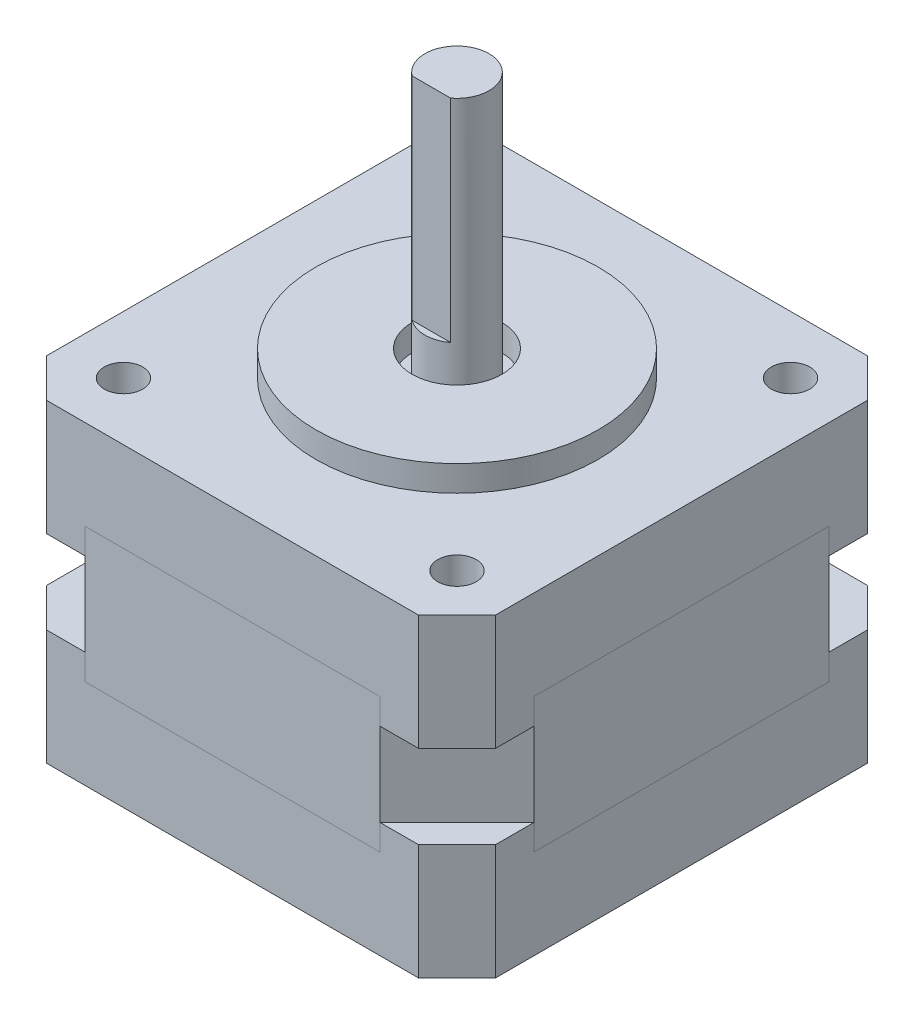
from build123d import *

# Parameters (mm, degrees)
BOSS_EXTRUDE1_DEPTH = 9
CUT_EXTRUDE7_DEPTH  = 2
BOSS_EXTRUDE2_DEPTH = 10.5
SKETCH11_R          = 11
BOSS_EXTRUDE3_DEPTH = 2
SKETCH12_R          = 2.5
CUT_EXTRUDE8_DEPTH  = 10.5
SKETCH13_R          = 3.5
CUT_EXTRUDE9_DEPTH  = 37.259481519
SKETCH14_R          = 2.5
BOSS_EXTRUDE4_DEPTH = 20.65
BOSS_EXTRUDE5_START = -2
SKETCH17_R          = 2.5
BOSS_EXTRUDE5_DEPTH = 22.5
CUT_EXTRUDE10_DEPTH = 16.5
SKETCH18_R          = 1.5
CUT_EXTRUDE11_DEPTH = 4
SKETCH19_R          = 3.45
SKETCH19_R_2        = 2.55
BOSS_EXTRUDE6_DEPTH = 1


with BuildPart() as part:
    # Sketch1 → Boss-Extrude1 (new body)
    with BuildSketch(Plane(origin=(0, 0, 0), x_dir=(1, 0, 0), z_dir=(0, 1, 0))):
        Polygon((-17.5, 14.5), (-14.5, 17.5), (14.5, 17.5), (17.5, 14.5), (17.5, -14.5), (14.5, -17.5), (-14.5, -17.5), (-17.5, -14.5), align=None)
    extrude(amount=-BOSS_EXTRUDE1_DEPTH)

    # Sketch9 → Cut-Extrude7 (cut)
    with BuildSketch(Plane.XZ.offset(9)):
        Polygon((-11.5, -17.5), (11.5, -17.5), (17.5, -11.5), (17.5, 11.5), (11.5, 17.5), (-11.5, 17.5), (-17.5, 11.5), (-17.5, -11.5), align=None)
    extrude(amount=-CUT_EXTRUDE7_DEPTH, mode=Mode.SUBTRACT)


with BuildPart() as body_2:
    # Sketch10 → Boss-Extrude2 (new body)
    with BuildSketch(Plane.XZ.offset(7)):
        Polygon((11.5, -17.5), (-11.5, -17.5), (-17.5, -11.5), (-17.5, 11.5), (-11.5, 17.5), (11.5, 17.5), (17.5, 11.5), (17.5, -11.5), align=None)
    extrude(amount=BOSS_EXTRUDE2_DEPTH)

    # Sketch12 → Cut-Extrude8 (cut)
    with BuildSketch(Plane(origin=(0, -7, 0), x_dir=(1, 0, 0), z_dir=(0, 1, 0))):
        with Locations(Location((0, 0, 0), (0, 0, 270))):
            Circle(SKETCH12_R)
    extrude(amount=-CUT_EXTRUDE8_DEPTH, mode=Mode.SUBTRACT)


with BuildPart() as body_3:
    # Mirror3: mirrored copy
    add(part.part.mirror(Plane.ZX.offset(-12.25)))


with BuildPart() as part_1:
    add(part.part)

    # Sketch11 → Boss-Extrude3 (add)
    with BuildSketch(Plane(origin=(0, 0, 0), x_dir=(1, 0, 0), z_dir=(0, 1, 0))):
        with Locations(Location((0, 0, 0), (0, 0, 270))):
            Circle(SKETCH11_R)
    extrude(amount=BOSS_EXTRUDE3_DEPTH)


with BuildPart() as cut_extrude9_tool:
    # Sketch13 → Cut-Extrude9 (new, through all)
    with BuildSketch(Plane(origin=(0, 2, 0), x_dir=(1, 0, 0), z_dir=(0, 1, 0))):
        with Locations(Location((0, 0, 0), (0, 0, 270))):
            Circle(SKETCH13_R)
    extrude(amount=-CUT_EXTRUDE9_DEPTH)


with BuildPart() as body_3_1:
    add(body_3.part)

    # Cut-Extrude9: cut by cut_extrude9_tool
    add(cut_extrude9_tool.part, mode=Mode.SUBTRACT)


with BuildPart() as part_2:
    add(part_1.part)

    # Cut-Extrude9: cut by cut_extrude9_tool
    add(cut_extrude9_tool.part, mode=Mode.SUBTRACT)

    # Sketch18 → Cut-Extrude11 (cut)
    with BuildSketch(Plane(origin=(0, 0, 0), x_dir=(1, 0, 0), z_dir=(0, 1, 0))):
        with Locations(Location((-13, 13, 0), (0, 0, 270))):
            Circle(SKETCH18_R)
        with Locations(Location((13, 13, 0), (0, 0, 90))):
            Circle(SKETCH18_R)
        with Locations(Location((13, -13, 0), (0, 0, 270))):
            Circle(SKETCH18_R)
        with Locations(Location((-13, -13, 0), (0, 0, 90))):
            Circle(SKETCH18_R)
    extrude(amount=-CUT_EXTRUDE11_DEPTH, mode=Mode.SUBTRACT)


with BuildPart() as body_4:
    # Sketch14 → Boss-Extrude4 (new body)
    with BuildSketch(Plane(origin=(0, 0, 0), x_dir=(1, 0, 0), z_dir=(0, 1, 0))):
        with Locations(Location((0, 0, 0), (0, 0, 90))):
            Circle(SKETCH14_R)
    extrude(amount=BOSS_EXTRUDE4_DEPTH)

    # Sketch17 → Boss-Extrude5 (add)
    with BuildSketch(Plane.XZ.offset(24.5).offset(BOSS_EXTRUDE5_START)):
        with Locations(Location((0, 0, 0), (0, 0, 270))):
            Circle(SKETCH17_R)
    extrude(amount=-BOSS_EXTRUDE5_DEPTH)

    # Sketch15 → Cut-Extrude10 (cut)
    with BuildSketch(Plane(origin=(0, 20.65, 0), x_dir=(1, 0, 0), z_dir=(0, 1, 0))):
        with BuildLine():
            Line((0, -2), (-1.5, -2))
            ThreePointArc((-1.5, -2), (0, -2.5), (1.5, -2))
            Line((1.5, -2), (0, -2))
        make_face()
    extrude(amount=-CUT_EXTRUDE10_DEPTH, mode=Mode.SUBTRACT)


with BuildPart() as body_5:
    # Sketch19 → Boss-Extrude6 (new body)
    with BuildSketch(Plane(origin=(0, 0, 0), x_dir=(1, 0, 0), z_dir=(0, 1, 0))):
        with Locations(Location((0, 0, 0), (0, 0, 270))):
            Circle(SKETCH19_R)
        with Locations(Location((0, 0, 0), (0, 0, 270))):
            Circle(SKETCH19_R_2, mode=Mode.SUBTRACT)
    extrude(amount=-BOSS_EXTRUDE6_DEPTH)


solid = Compound([body_2.part, body_3_1.part, part_2.part, body_4.part, body_5.part])
